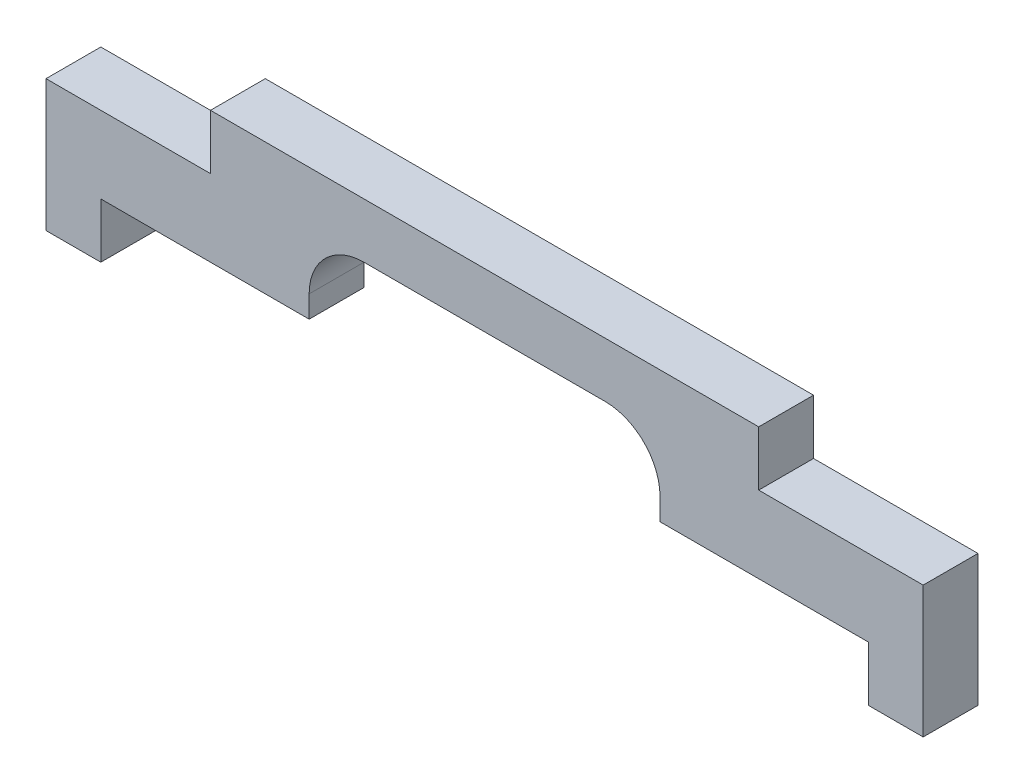
from build123d import *

# Parameters (mm, degrees)
BOSS_EXTRU_1_DEPTH = 5
BOSS_EXTRU_2_DEPTH = 5


with BuildPart() as part:
    # Esquisse1 → Boss.-Extru.1 (new body)
    with BuildSketch(Plane.XY):
        Polygon((-16, -12), (-16, -5), (16, -5), (16, -12), (35, -12), (35, -17), (40, -17), (40, -5), (25, -5), (25, 0), (-25, 0), (-25, -5), (-40, -5), (-40, -17), (-35, -17), (-35, -12), align=None)
    extrude(amount=BOSS_EXTRU_1_DEPTH)

    # Esquisse2 → Boss.-Extru.2 (add)
    with BuildSketch(Plane.XY.offset(5)):
        with BuildLine():
            Line((-16, -10), (-16, -3.900376605))
            Line((-16, -3.900376605), (16, -3.900376605))
            Line((16, -3.900376605), (16, -10))
            ThreePointArc((16, -10), (14.535533906, -6.464466094), (11, -5))
            Line((11, -5), (-11, -5))
            ThreePointArc((-11, -5), (-14.535533906, -6.464466094), (-16, -10))
        make_face()
    extrude(amount=-BOSS_EXTRU_2_DEPTH)


solid = part.part
